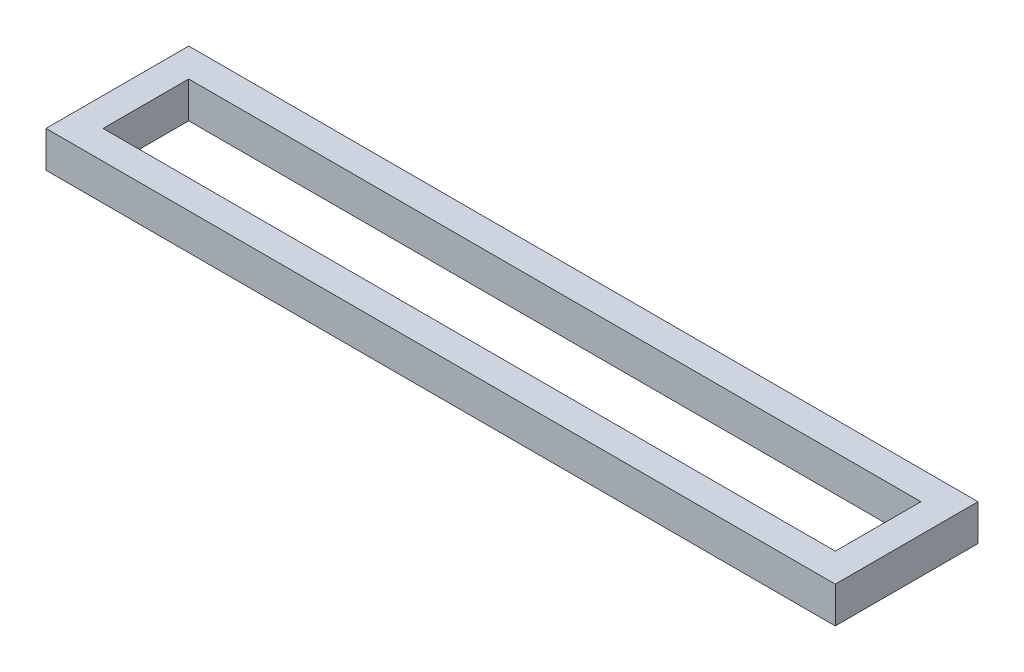
from build123d import *

# Parameters (mm, degrees)
SKETCH1_W           = 138.25
SKETCH1_H           = 25
SKETCH1_W_2         = 128.25
SKETCH1_H_2         = 15
BOSS_EXTRUDE1_DEPTH = 6.35


with BuildPart() as part:
    # Sketch1 → Boss-Extrude1 (new body)
    with BuildSketch(Plane(origin=(0, 0, 0), x_dir=(1, 0, 0), z_dir=(0, 1, 0))):
        with Locations((64.125, 7.5)):
            Rectangle(SKETCH1_W, SKETCH1_H)
        with Locations((64.125, 7.5)):
            Rectangle(SKETCH1_W_2, SKETCH1_H_2, mode=Mode.SUBTRACT)
    extrude(amount=BOSS_EXTRUDE1_DEPTH)


solid = part.part
